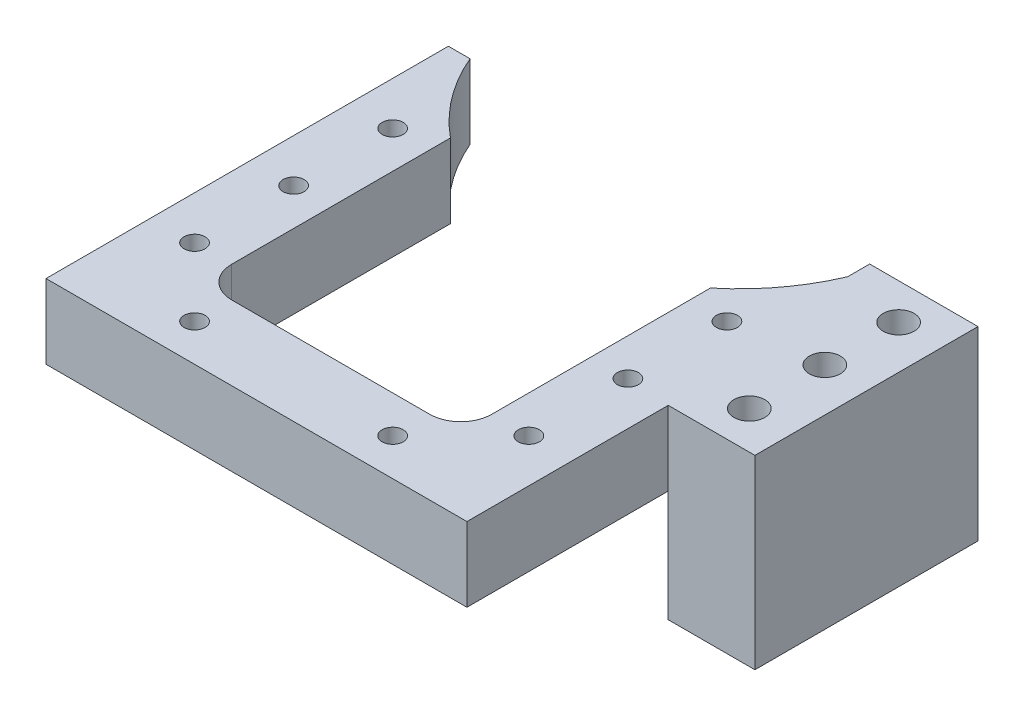
from build123d import *

# Parameters (mm, degrees)
SKETCH1_R                = 0.85
BOSS_EXTRUDE1_DEPTH      = 6
BOSS_EXTRUDE2_DEPTH      = 9
BOSS_EXTRUDE2_DEPTH_BACK = 6
SKETCH4_R                = 1.25
CUT_EXTRUDE2_DEPTH       = 49.187135213
CUT_EXTRUDE3_DEPTH       = 10
SKETCH7_W                = 1.75
SKETCH7_H                = 1.78
BOSS_EXTRUDE4_DEPTH      = 6


with BuildPart() as part:
    # Sketch1 → Boss-Extrude1 (new body)
    with BuildSketch(Plane(origin=(0, 0, 0), x_dir=(1, 0, 0), z_dir=(0, 1, 0))):
        with BuildLine():
            Line((-17, -6.5), (-17, -33.5))
            Line((-17, -33.5), (-17, -39))
            Line((-17, -39), (17, -39))
            Line((17, -39), (17, -33.5))
            Line((17, -33.5), (17, -6.5))
            Line((17, -6.5), (15.25, -6.5))
            ThreePointArc((15.25, -6.5), (13.258096668, -9.951651759), (10.5, -12.828191611))
            Line((10.5, -12.828191611), (10.5, -30.5))
            Line((10.5, -30.5), (8, -30.5))
            Line((8, -30.5), (8, -33))
            Line((8, -33), (-8, -33))
            Line((-8, -33), (-8, -30.5))
            Line((-8, -30.5), (-10.5, -30.5))
            Line((-10.5, -30.5), (-10.5, -12.828191611))
            ThreePointArc((-10.5, -12.828191611), (-13.258096668, -9.951651759), (-15.25, -6.5))
            Line((-15.25, -6.5), (-17, -6.5))
        make_face()
        with Locations(Location((-13.5, -30.5, 0), (0, 0, 270))):
            Circle(SKETCH1_R, mode=Mode.SUBTRACT)
        with Locations(Location((-13.5, -22.5, 0), (0, 0, 270))):
            Circle(SKETCH1_R, mode=Mode.SUBTRACT)
        with Locations(Location((-13.5, -14.5, 0), (0, 0, 270))):
            Circle(SKETCH1_R, mode=Mode.SUBTRACT)
        with Locations(Location((-8, -36, 0), (0, 0, 270))):
            Circle(SKETCH1_R, mode=Mode.SUBTRACT)
        with Locations(Location((8, -36, 0), (0, 0, 270))):
            Circle(SKETCH1_R, mode=Mode.SUBTRACT)
        with Locations(Location((13.5, -30.5, 0), (0, 0, 270))):
            Circle(SKETCH1_R, mode=Mode.SUBTRACT)
        with Locations(Location((13.5, -22.5, 0), (0, 0, 270))):
            Circle(SKETCH1_R, mode=Mode.SUBTRACT)
        with Locations(Location((13.5, -14.5, 0), (0, 0, 270))):
            Circle(SKETCH1_R, mode=Mode.SUBTRACT)
    extrude(amount=BOSS_EXTRUDE1_DEPTH)

    # Sketch3 → Boss-Extrude2 (add, two sides: drawn at the far end of the back side and taken through both)
    with BuildSketch(Plane.XZ.offset(-BOSS_EXTRUDE2_DEPTH_BACK)):
        Polygon((17, 22.74), (24, 22.74), (24, 4.72), (17, 4.72), (17, 7.901808389), align=None)
    extrude(amount=BOSS_EXTRUDE2_DEPTH + BOSS_EXTRUDE2_DEPTH_BACK)

    # Sketch4 → Cut-Extrude2 (cut, through all)
    with BuildSketch(Plane.XZ.offset(9)):
        with Locations(Location((20.5, 7.63, 0), (0, 0, 270))):
            Circle(SKETCH4_R)
        with Locations(Location((20.5, 13.59, 0), (0, 0, 270))):
            Circle(SKETCH4_R)
        with Locations(Location((20.5, 19.69, 0), (0, 0, 270))):
            Circle(SKETCH4_R)
    extrude(amount=-CUT_EXTRUDE2_DEPTH, mode=Mode.SUBTRACT)

    # Sketch5 → Cut-Extrude3 (cut)
    with BuildSketch(Plane.XZ):
        with BuildLine():
            Line((8, 33), (-8, 33))
            ThreePointArc((-8, 33), (-9.767766953, 32.267766953), (-10.5, 30.5))
            Line((-10.5, 30.5), (10.5, 30.5))
            ThreePointArc((10.5, 30.5), (9.767766953, 32.267766953), (8, 33))
        make_face()
    extrude(amount=-CUT_EXTRUDE3_DEPTH, mode=Mode.SUBTRACT)

    # Sketch7 → Boss-Extrude4 (add)
    with BuildSketch(Plane(origin=(0, 6, 0), x_dir=(1, 0, 0), z_dir=(0, 1, 0))):
        with Locations((16.125, -5.61)):
            Rectangle(SKETCH7_W, SKETCH7_H)
    extrude(amount=-BOSS_EXTRUDE4_DEPTH)


solid = part.part
